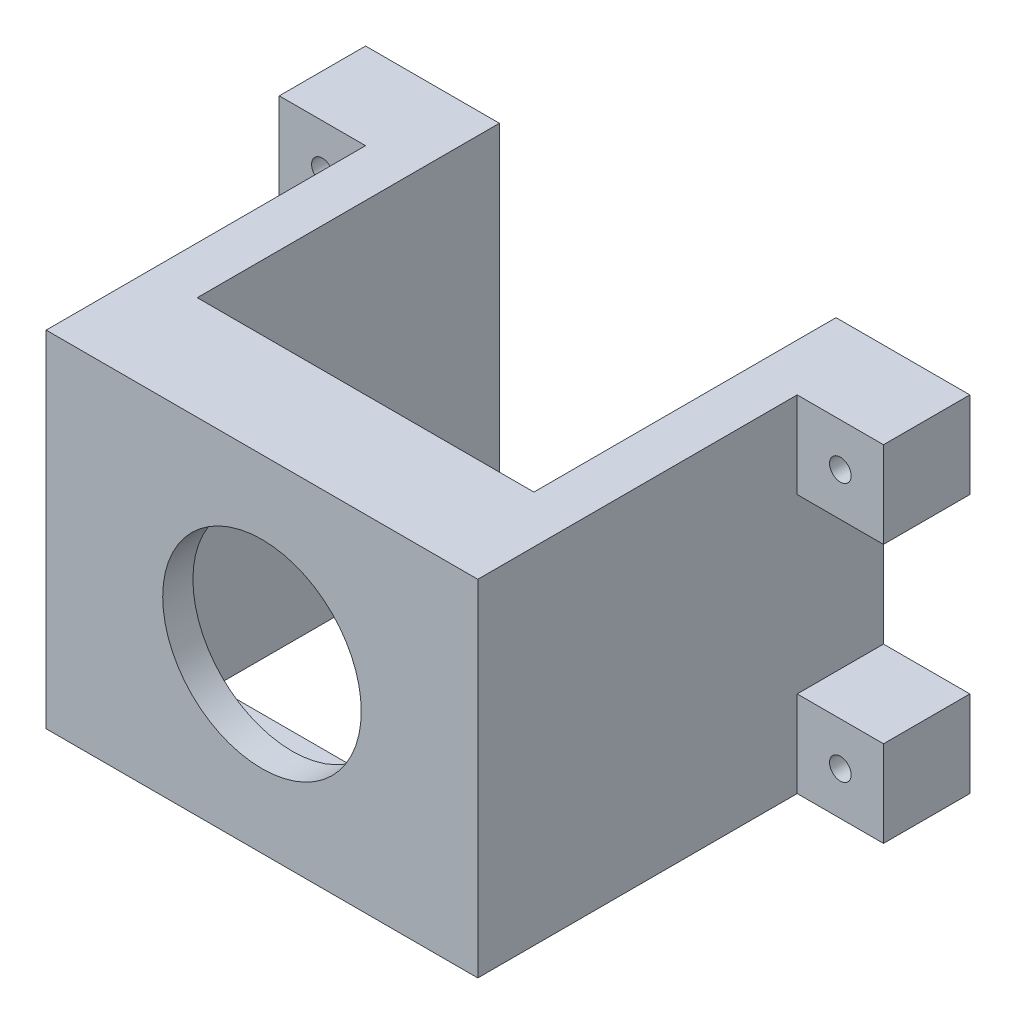
from build123d import *

# Parameters (mm, degrees)
SKETCH_1_W               = 50
SKETCH_1_H               = 40
EXTRUDE_2_DEPTH          = 47
SKETCH_3_W               = 70
SKETCH_3_H               = 10
EXTRUDE_3_DEPTH          = 10
CUT_EXTRUDE_1_DEPTH      = 62.919302322
CUT_EXTRUDE_1_DEPTH_BACK = 62.919302322
SKETCH_4_R               = 11.5
SKETCH_5_W               = 39
SKETCH_5_H               = 36
CUT_EXTRUDE_2_DEPTH      = 43.5
M3X0_5_1_D               = 2.5
SKETCH_8_W               = 39
SKETCH_8_H               = 70
CUT_EXTRUDE_3_DEPTH      = 35


with BuildPart() as part:
    # ｽｹｯﾁ1 → ﾎﾞｽ - 押し出し2 (new body)
    with BuildSketch(Plane.XY):
        Rectangle(SKETCH_1_W, SKETCH_1_H)
    extrude(amount=EXTRUDE_2_DEPTH)

    # ｽｹｯﾁ3 → ﾎﾞｽ - 押し出し3 (add)
    with BuildSketch(Plane.XY):
        with Locations((0, -15)):
            Rectangle(SKETCH_3_W, SKETCH_3_H)
    extrude_3 = extrude(amount=EXTRUDE_3_DEPTH)

    # ｽｹｯﾁ4 → ｶｯﾄ - 押し出し1 (cut, two sides: drawn at the far end of the back side and taken through both)
    with BuildSketch(Plane.XY.offset(-CUT_EXTRUDE_1_DEPTH_BACK)):
        Circle(SKETCH_4_R)
    extrude(amount=CUT_EXTRUDE_1_DEPTH + CUT_EXTRUDE_1_DEPTH_BACK, mode=Mode.SUBTRACT)

    # ｽｹｯﾁ5 → ｶｯﾄ - 押し出し2 (cut)
    with BuildSketch(Plane.XY):
        Rectangle(SKETCH_5_W, SKETCH_5_H)
    cut_extrude_2 = extrude(amount=CUT_EXTRUDE_2_DEPTH, mode=Mode.SUBTRACT)

    # M3x0.5 ねじ穴1 (through all)
    with Locations(Plane.XY.offset(10)):
        with Locations((30, -15), (-30, -15)):
            m3x0_5_1 = Hole(M3X0_5_1_D / 2)

    # ｽｹｯﾁ8 → ｶｯﾄ - 押し出し3 (cut)
    with BuildSketch(Plane(origin=(0, 0, 0), x_dir=(-1, 0, 0), z_dir=(0, 0, -1))):
        Rectangle(SKETCH_8_W, SKETCH_8_H)
    cut_extrude_3 = extrude(amount=-CUT_EXTRUDE_3_DEPTH, mode=Mode.SUBTRACT)

    # ﾐﾗｰ4: ﾎﾞｽ - 押し出し3, ｶｯﾄ - 押し出し2, M3x0.5 ねじ穴1, ｶｯﾄ - 押し出し3 across plane
    add(extrude_3.mirror(Plane.ZX))
    add(cut_extrude_2.mirror(Plane.ZX), mode=Mode.SUBTRACT)
    add(m3x0_5_1.mirror(Plane.ZX), mode=Mode.SUBTRACT)
    add(cut_extrude_3.mirror(Plane.ZX), mode=Mode.SUBTRACT)


solid = part.part
